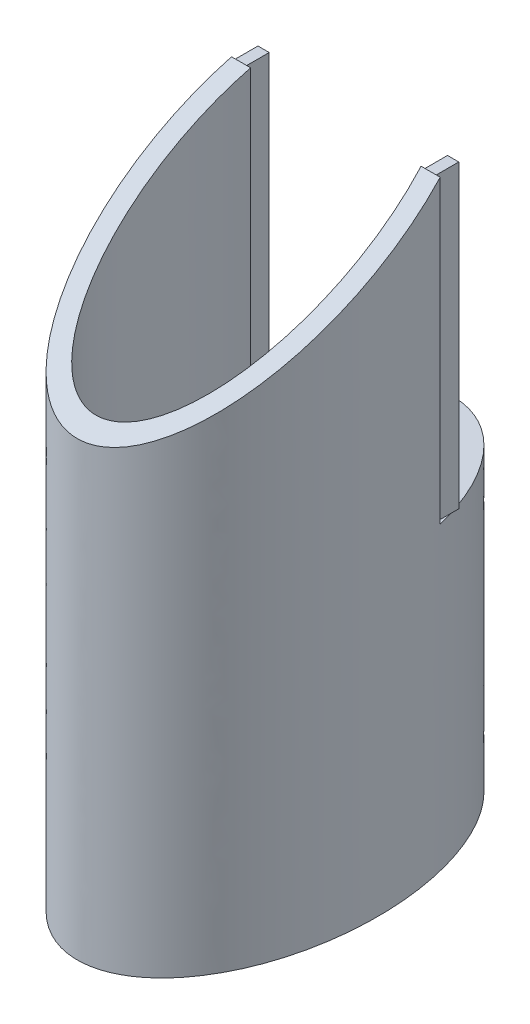
from build123d import *

# Parameters (mm, degrees)
SKETCH1_RX              = 25
SKETCH1_RY              = 15
SKETCH1_RX_2            = 22.5
SKETCH1_RY_2            = 12.5
BOSS_EXTRUDE1_DEPTH     = 80
CUT_EXTRUDE1_DEPTH      = 86.14693183
CUT_EXTRUDE1_DEPTH_BACK = 86.14693183
CUT_EXTRUDE2_DEPTH      = 86.146931971
CUT_EXTRUDE2_DEPTH_BACK = 86.146931971
SKETCH6_W               = 15.567596141
SKETCH6_H               = 40
SKETCH10_W              = 1.5
SKETCH10_H              = 40
BOSS_EXTRUDE2_DEPTH     = 3


with BuildPart() as part:
    # Sketch1 → Boss-Extrude1 (new body)
    with BuildSketch(Plane(origin=(0, 0, 0), x_dir=(1, 0, 0), z_dir=(0, 1, 0))):
        with Locations(Location((0, 0), (0, 0, 90))):
            Ellipse(SKETCH1_RX, SKETCH1_RY)
        with Locations(Location((0, 0), (0, 0, 90))):
            Ellipse(SKETCH1_RX_2, SKETCH1_RY_2, mode=Mode.SUBTRACT)
    extrude(amount=BOSS_EXTRUDE1_DEPTH)

    # Sketch5 → Cut-Extrude1 (cut, two sides: drawn at the far end of the back side and taken through both)
    with BuildSketch(Plane(origin=(0, 0, 0), x_dir=(0, 0, -1), z_dir=(1, 0, 0)).offset(-CUT_EXTRUDE1_DEPTH_BACK)):
        Polygon((9.432403859, 80), (-25, 60.125468033), (-25, 80), align=None)
    extrude(amount=CUT_EXTRUDE1_DEPTH + CUT_EXTRUDE1_DEPTH_BACK, mode=Mode.SUBTRACT)

    # Sketch6 → Cut-Extrude2 (cut, two sides: drawn at the far end of the back side and taken through both)
    with BuildSketch(Plane(origin=(0, 0, 0), x_dir=(0, 0, -1), z_dir=(1, 0, 0)).offset(-CUT_EXTRUDE2_DEPTH_BACK)):
        with Locations((17.21620193, 60)):
            Rectangle(SKETCH6_W, SKETCH6_H)
    extrude(amount=CUT_EXTRUDE2_DEPTH + CUT_EXTRUDE2_DEPTH_BACK, mode=Mode.SUBTRACT)

    # Sketch10 → Boss-Extrude2 (add)
    with BuildSketch(Plane(origin=(0, 0, -9.432403859), x_dir=(-1, 0, 0), z_dir=(0, 0, -1))):
        with Locations((-12.619980104, 60)):
            Rectangle(SKETCH10_W, SKETCH10_H)
    boss_extrude2 = extrude(amount=BOSS_EXTRUDE2_DEPTH)

    # Mirror1: Boss-Extrude2 across plane
    add(boss_extrude2.mirror(Plane(origin=(0, 0, 0), x_dir=(0, 0, 1), z_dir=(1, 0, 0))))


solid = part.part
